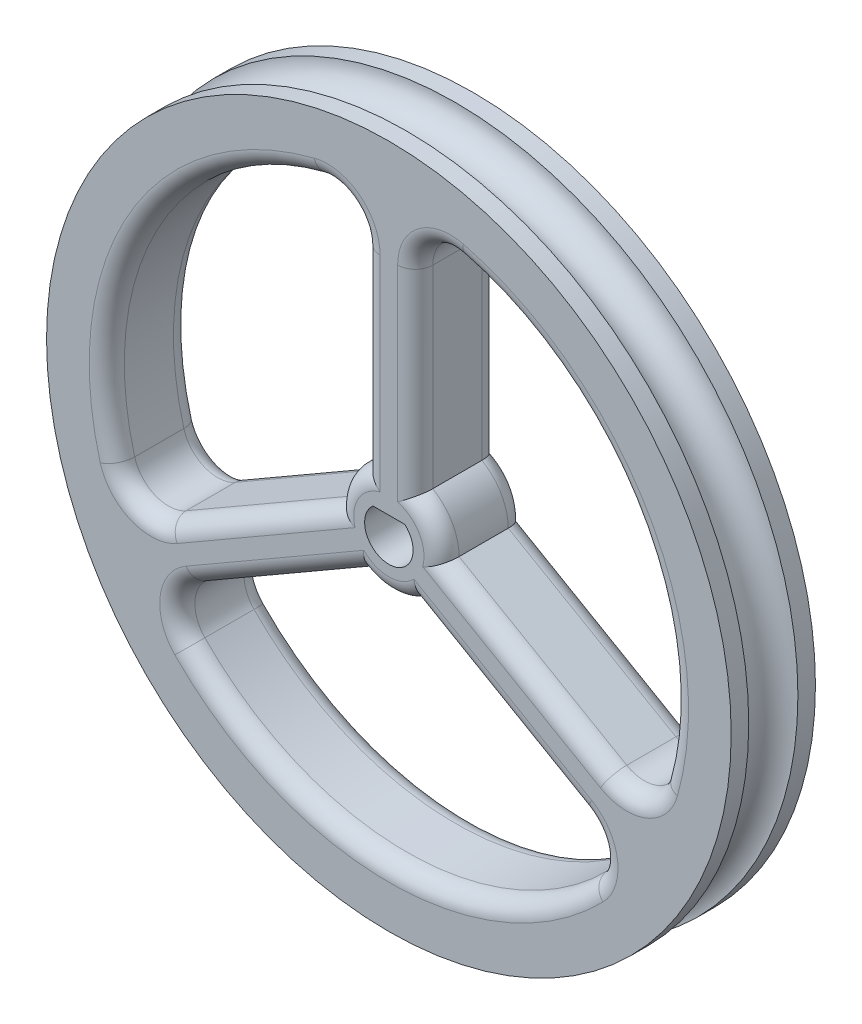
from build123d import *

# Parameters (mm, degrees)
SKETCH1_R           = 24.765
BOSS_EXTRUDE1_DEPTH = 6.096
SKETCH3_R           = 1.778
CUT_EXTRUDE1_REACH  = 37.55
FILLET1_R           = 2.54
CUT_EXTRUDE2_REACH  = 37.55
FILLET2_R           = 1.27
CHAMFER1_SIZE       = 0.635


with BuildPart() as part:
    # Sketch1 → Boss-Extrude1 (new body)
    with BuildSketch(Plane.XY):
        Circle(SKETCH1_R)
    extrude(amount=BOSS_EXTRUDE1_DEPTH)

    # Sketch3 → Cut-Revolve1 (revolve, cut)
    with BuildSketch(Plane(origin=(0, 0, 0), x_dir=(0, 0, -1), z_dir=(1, 0, 0))):
        with Locations((-3.048, 24.765)):
            Circle(SKETCH3_R)
    revolve(axis=Axis((0, 0, 6.096), (0, 0, -1)), mode=Mode.SUBTRACT)

    # Sketch6 → Cut-Extrude1 (cut, up to next)
    with BuildSketch(Plane(origin=(0, 0, 0), x_dir=(-1, 0, 0), z_dir=(0, 0, -1)), mode=Mode.PRIVATE) as cut_extrude1_sk1:
        with BuildLine():
            Line((1.905, 20.32), (1.905, 3.299556788))
            ThreePointArc((1.905, 3.299556788), (3.299556788, 1.905), (3.81, 0))
            Line((3.81, 0), (18.550136205, -8.510221606))
            ThreePointArc((18.550136205, -8.510221606), (17.674800388, 10.204550762), (1.905, 20.32))
        make_face()
    cut_extrude1_tool1 = extrude(cut_extrude1_sk1.sketch, amount=-CUT_EXTRUDE1_REACH, mode=Mode.PRIVATE) & part.part
    # Sketch6 → Cut-Extrude1 (cut, up to next)
    with BuildSketch(Plane(origin=(0, 0, 0), x_dir=(-1, 0, 0), z_dir=(0, 0, -1)), mode=Mode.PRIVATE) as cut_extrude1_sk2:
        with BuildLine():
            ThreePointArc((-3.81, 0), (-3.299556788, 1.905), (-1.905, 3.299556788))
            Line((-1.905, 3.299556788), (-1.905, 20.32))
            ThreePointArc((-1.905, 20.32), (-17.674800388, 10.204550762), (-18.550136205, -8.510221606))
            Line((-18.550136205, -8.510221606), (-3.81, 0))
        make_face()
    cut_extrude1_tool2 = extrude(cut_extrude1_sk2.sketch, amount=-CUT_EXTRUDE1_REACH, mode=Mode.PRIVATE) & part.part
    # Sketch6 → Cut-Extrude1 (cut, up to next)
    with BuildSketch(Plane(origin=(0, 0, 0), x_dir=(-1, 0, 0), z_dir=(0, 0, -1)), mode=Mode.PRIVATE) as cut_extrude1_sk3:
        with BuildLine():
            Line((16.645136205, -11.809778394), (1.905, -3.299556788))
            ThreePointArc((1.905, -3.299556788), (0, -3.81), (-1.905, -3.299556788))
            Line((-1.905, -3.299556788), (-16.645136205, -11.809778394))
            ThreePointArc((-16.645136205, -11.809778394), (0, -20.409101524), (16.645136205, -11.809778394))
        make_face()
    cut_extrude1_tool3 = extrude(cut_extrude1_sk3.sketch, amount=-CUT_EXTRUDE1_REACH, mode=Mode.PRIVATE) & part.part
    add(cut_extrude1_tool1.solids().sort_by_distance((-10.764795, 6.215057, 0))[0], mode=Mode.SUBTRACT)
    add(cut_extrude1_tool2.solids().sort_by_distance((10.764795, 6.215057, 0))[0], mode=Mode.SUBTRACT)
    add(cut_extrude1_tool3.solids().sort_by_distance((0, -12.430115, 0))[0], mode=Mode.SUBTRACT)

    # Fillet1
    fillet1_edges = [part.edges().sort_by_distance(p)[0] for p in [
        (-18.550136205, -8.510221606, 3.048),
        (-16.645136205, -11.809778394, 3.048),
        (16.645136205, -11.809778394, 3.048),
        (18.550136205, -8.510221606, 3.048),
        (-1.905, 20.32, 3.048),
        (1.905, 20.32, 3.048),
    ]]
    fillet(fillet1_edges, radius=FILLET1_R)

    # Sketch6<4> → Cut-Extrude2 (cut, up to next)
    with BuildSketch(Plane(origin=(0, 0, 0), x_dir=(-1, 0, 0), z_dir=(0, 0, -1)), mode=Mode.PRIVATE) as cut_extrude2_sk1:
        with BuildLine():
            Line((1.148146332, 1.326), (-1.148146332, 1.326))
            ThreePointArc((-1.148146332, 1.326), (0, -1.754), (1.148146332, 1.326))
        make_face()
    cut_extrude2_tool1 = extrude(cut_extrude2_sk1.sketch, amount=-CUT_EXTRUDE2_REACH, mode=Mode.PRIVATE) & part.part
    add(cut_extrude2_tool1.solids().sort_by_distance((0, -0.112212, 0))[0], mode=Mode.SUBTRACT)

    # Fillet2
    fillet2_edges = [part.edges().sort_by_distance(p)[0] for p in [
        (-15.282675642, -12.158557562, 0),
        (-7.970582412, -6.801522427, 0),
        (0, -3.81, 0),
        (7.970582412, -6.801522427, 0),
        (15.282675642, -12.158557562, 0),
        (0, -20.409101524, 0),
        (-2.888281901, 19.314464124, 0),
        (-1.905, 10.303488065, 0),
        (-3.299556788, 1.905, 0),
        (-9.875582412, -3.501965638, 0),
        (-18.170957543, -7.155906562, 0),
        (-17.674800388, 10.204550762, 0),
        (18.170957543, -7.155906562, 0),
        (9.875582412, -3.501965638, 0),
        (3.299556788, 1.905, 0),
        (1.905, 10.303488065, 0),
        (2.888281901, 19.314464124, 0),
        (17.674800388, 10.204550762, 0),
        (0, -3.81, 6.096),
        (-7.970582412, -6.801522427, 6.096),
        (-15.282675642, -12.158557562, 6.096),
        (0, -20.409101524, 6.096),
        (15.282675642, -12.158557562, 6.096),
        (7.970582412, -6.801522427, 6.096),
        (-3.299556788, 1.905, 6.096),
        (-1.905, 10.303488065, 6.096),
        (-2.888281901, 19.314464124, 6.096),
        (-17.674800388, 10.204550762, 6.096),
        (-18.170957543, -7.155906562, 6.096),
        (-9.875582412, -3.501965638, 6.096),
        (3.299556788, 1.905, 6.096),
        (9.875582412, -3.501965638, 6.096),
        (18.170957543, -7.155906562, 6.096),
        (17.674800388, 10.204550762, 6.096),
        (2.888281901, 19.314464124, 6.096),
        (1.905, 10.303488065, 6.096),
    ]]
    fillet(fillet2_edges, radius=FILLET2_R)

    # Chamfer1
    chamfer1_edges = [part.edges().sort_by_distance(p)[0] for p in [
        (0, 1.326, 0),
        (0, -1.754, 0),
    ]]
    chamfer(chamfer1_edges, length=CHAMFER1_SIZE)


solid = part.part
